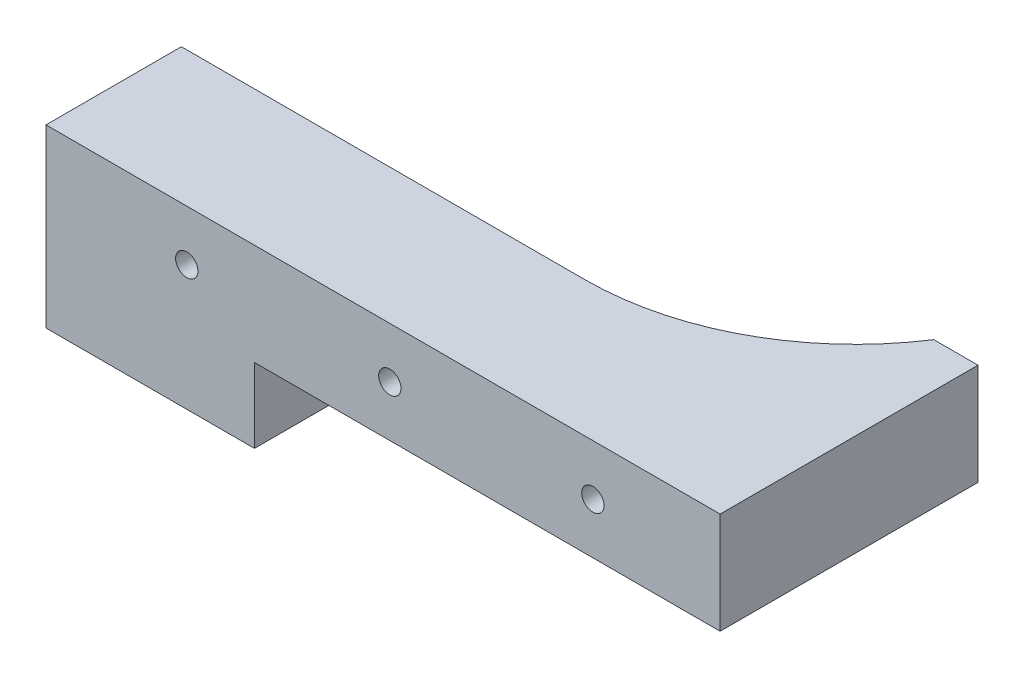
from build123d import *

# Parameters (mm, degrees)
SKETCH1_R               = 1.65
BOSS_EXTRUDE1_DEPTH     = 38.1
SKETCH3_R               = 1.65
CUT_EXTRUDE1_DEPTH      = 20
CUT_EXTRUDE3_DEPTH      = 146.219699553
CUT_EXTRUDE3_DEPTH_BACK = 146.219699553


with BuildPart() as part:
    # Sketch1 → Boss-Extrude1 (new body)
    with BuildSketch(Plane.XY):
        Polygon((-7.90964601, 27), (-137.699495781, 27), (-137.699495781, 1), (-106.9, 1), (-106.9, 12), (-7.90964601, 12), align=None)
        with Locations((-116.9, 19.5)):
            Circle(SKETCH1_R, mode=Mode.SUBTRACT)
        with Locations((-86.9, 19.5)):
            Circle(SKETCH1_R, mode=Mode.SUBTRACT)
        with Locations((-56.9, 19.5)):
            Circle(SKETCH1_R, mode=Mode.SUBTRACT)
        with Locations((-26.9, 19.5)):
            Circle(SKETCH1_R, mode=Mode.SUBTRACT)
    extrude(amount=-BOSS_EXTRUDE1_DEPTH)

    # Sketch3 → Cut-Extrude1 (cut)
    with BuildSketch(Plane.ZY.offset(137.699495781)):
        with Locations((-10.698507709, 14)):
            Circle(SKETCH3_R)
    extrude(amount=-CUT_EXTRUDE1_DEPTH, mode=Mode.SUBTRACT)

    # Sketch4 → Cut-Extrude3 (cut, two sides: drawn at the far end of the back side and taken through both)
    with BuildSketch(Plane(origin=(0, 27, 0), x_dir=(1, 0, 0), z_dir=(0, 1, 0)).offset(-CUT_EXTRUDE3_DEPTH_BACK)):
        with BuildLine():
            ThreePointArc((-78.1, 20), (-59.07370241, 24.814775828), (-44.627772706, 38.1))
            Line((-44.627772706, 38.1), (-137.699495781, 38.1))
            Line((-137.699495781, 38.1), (-137.699495781, 20))
            Line((-137.699495781, 20), (-106.9, 20))
            Line((-106.9, 20), (-78.1, 20))
        make_face()
        Polygon((-38.1, 32.773477062), (-38.1, 28.046305235), (-38.1, 0), (-7.90964601, 0), (-7.90964601, 38.1), (-38.1, 38.1), align=None)
    extrude(amount=CUT_EXTRUDE3_DEPTH + CUT_EXTRUDE3_DEPTH_BACK, mode=Mode.SUBTRACT)


solid = part.part
